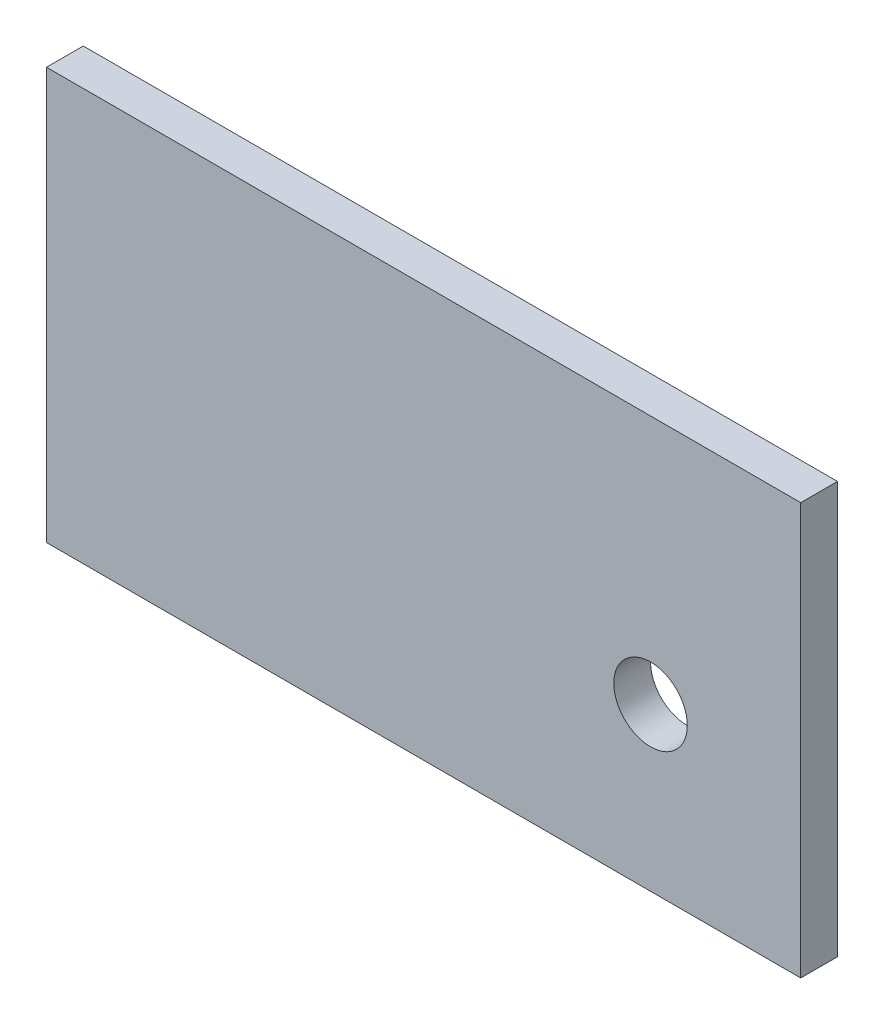
from build123d import *

# Parameters (mm, degrees)
SKETCH1_W           = 65.151
SKETCH1_H           = 35.56
SKETCH1_R           = 3.175
BOSS_EXTRUDE1_DEPTH = 3.175


with BuildPart() as part:
    # Sketch1 → Boss-Extrude1 (new body)
    with BuildSketch(Plane.XY):
        with Locations((32.5755, 17.78)):
            Rectangle(SKETCH1_W, SKETCH1_H)
        with Locations((52.175829049, 13.983451248)):
            Circle(SKETCH1_R, mode=Mode.SUBTRACT)
    extrude(amount=BOSS_EXTRUDE1_DEPTH)


solid = part.part
